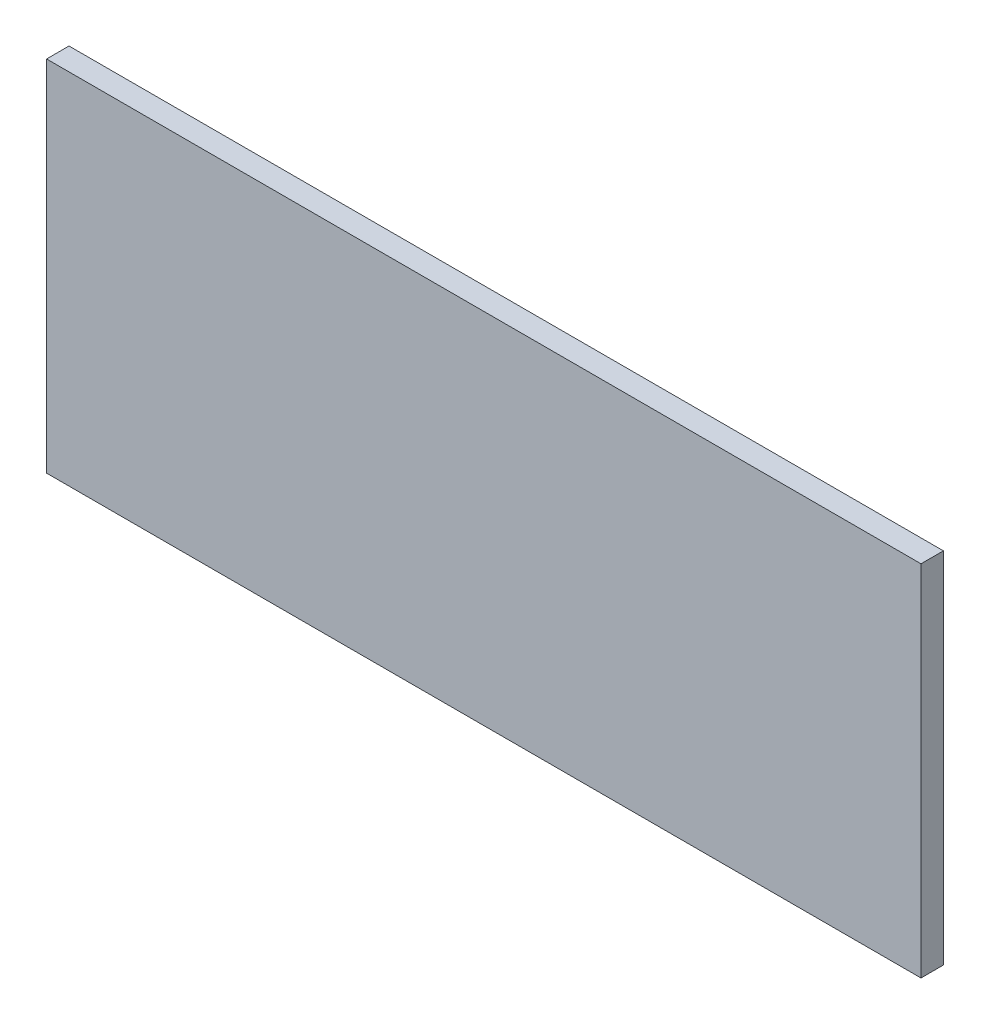
from build123d import *

# Parameters (mm, degrees)
SCHIZZO1_W                   = 39
SCHIZZO1_H                   = 16
ESTRUSIONE_ESTRUSIONE1_DEPTH = 1


with BuildPart() as part:
    # Schizzo1 → Estrusione-Estrusione1 (new body)
    with BuildSketch(Plane.XY):
        Rectangle(SCHIZZO1_W, SCHIZZO1_H)
    extrude(amount=ESTRUSIONE_ESTRUSIONE1_DEPTH)


solid = part.part
